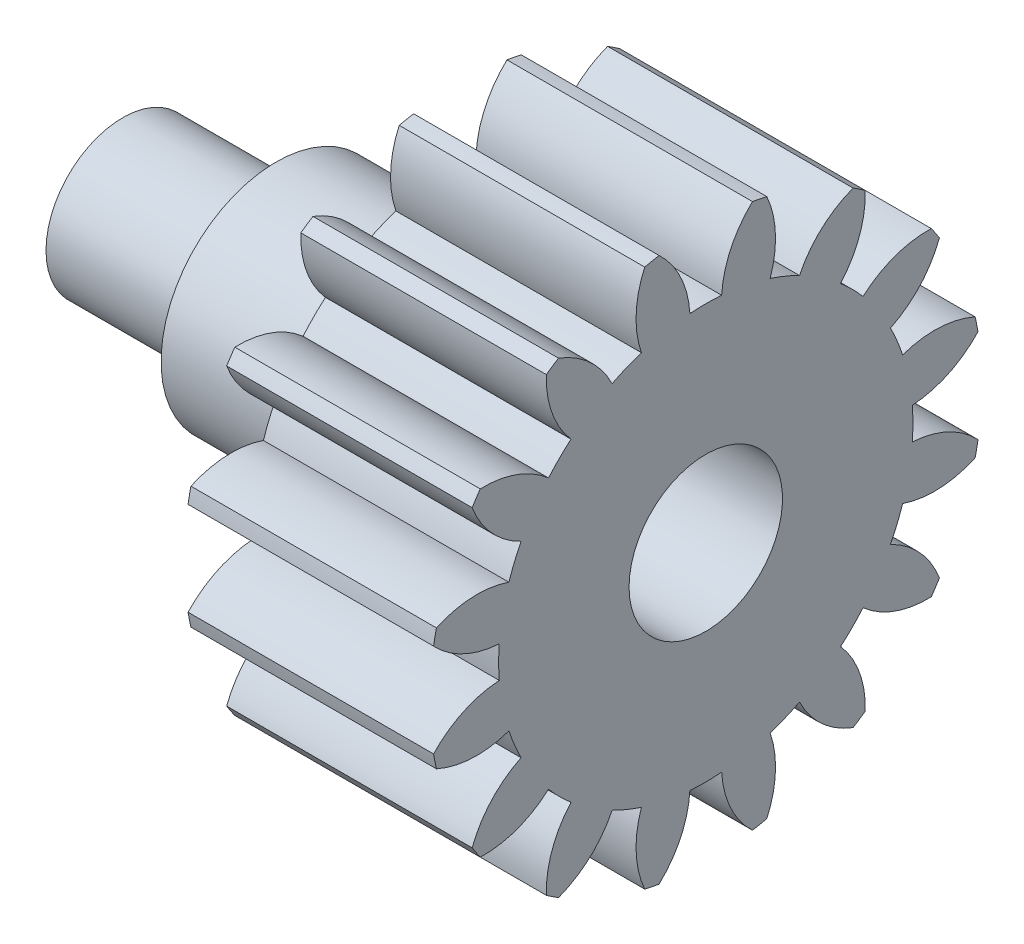
from build123d import *

# Parameters (mm, degrees)
BASPROSKE_W         = 16
BASPROSKE_H         = 18
TOOTHCUT_DEPTH      = 31.066592757
TEETHCUTS_COUNT     = 16
TEETHCUTS_ANGLE     = 337.5
HUBNEAONESKE_R      = 7.5
HUBNEARONE_DEPTH    = 22.0000508
BORSKE_R            = 5
BORE_DEPTH          = 38.0000508
CUT_EXTRUDE1_START  = -10
SKETCH3_R           = 7.5
CUT_EXTRUDE1_DEPTH  = 10
BOSS_EXTRUDE1_START = -10
SKETCH4_R           = 7.5
BOSS_EXTRUDE1_DEPTH = 10
SKETCH5_R           = 5
BOSS_EXTRUDE2_DEPTH = 10


with BuildPart() as part:
    # BasProSke → Base-Revolve (revolve)
    with BuildSketch(Plane(origin=(0, 0, 0), x_dir=(1, 0, 0), z_dir=(0, 1, 0)), mode=Mode.PRIVATE) as base_revolve_sk:
        with Locations((8, 9)):
            Rectangle(BASPROSKE_W, BASPROSKE_H)
    revolve(base_revolve_sk.sketch.rotate(Axis((-10, 0, 0), (1, 0, 0)), 180), axis=Axis((-10, 0, 0), (1, 0, 0)))

    # TooCutSke → ToothCut (cut, through all)
    with BuildSketch(Plane(origin=(0, 0, 0), x_dir=(0, 0, -1), z_dir=(1, 0, 0))):
        with BuildLine():
            ThreePointArc((1.03434411, 13.459313997), (0, 13.499), (-1.03434411, 13.459313997))
            ThreePointArc((-1.03434411, 13.459313997), (-1.635143665, 15.806872195), (-3.065655864, 17.762792553))
            ThreePointArc((-3.065655864, 17.762792553), (0, 18.0254), (3.065655864, 17.762792553))
            ThreePointArc((3.065655864, 17.762792553), (1.635143665, 15.806872195), (1.03434411, 13.459313997))
        make_face()
    toothcut = extrude(amount=TOOTHCUT_DEPTH, mode=Mode.SUBTRACT)

    # TeethCuts: ToothCut ×16 about axis
    teethcuts_axis = Axis((-10, 0, 0), (1, 0, 0))
    for i in range(1, TEETHCUTS_COUNT):
        add(toothcut.rotate(teethcuts_axis, i * TEETHCUTS_ANGLE / (TEETHCUTS_COUNT - 1)), mode=Mode.SUBTRACT)

    # HubNeaOneSke → HubNearOne (add)
    with BuildSketch(Plane.ZY):
        with Locations(Location((0, 0, 0), (0, 0, 180))):
            Circle(HUBNEAONESKE_R)
    extrude(amount=HUBNEARONE_DEPTH)

    # BorSke → Bore (cut, symmetric)
    with BuildSketch(Plane(origin=(0, 0, 0), x_dir=(0, 0, -1), z_dir=(1, 0, 0))):
        with Locations(Location((0, 0, 0), (0, 0, 180))):
            Circle(BORSKE_R)
    extrude(amount=BORE_DEPTH, both=True, mode=Mode.SUBTRACT)

    # Sketch3 → Cut-Extrude1 (cut)
    with BuildSketch(Plane.ZY.offset(22.0000508).offset(CUT_EXTRUDE1_START)):
        with Locations(Location((0, 0, 0), (0, 0, 180))):
            Circle(SKETCH3_R)
    extrude(amount=CUT_EXTRUDE1_DEPTH, mode=Mode.SUBTRACT)

    # Sketch4 → Boss-Extrude1 (add)
    with BuildSketch(Plane.ZY.offset(12.0000508).offset(BOSS_EXTRUDE1_START)):
        with Locations(Location((0, 0, 0), (0, 0, 180))):
            Circle(SKETCH4_R)
    extrude(amount=BOSS_EXTRUDE1_DEPTH)

    # Sketch5 → Boss-Extrude2 (add)
    with BuildSketch(Plane.ZY.offset(12.0000508)):
        Circle(SKETCH5_R)
    extrude(amount=BOSS_EXTRUDE2_DEPTH)


solid = part.part
